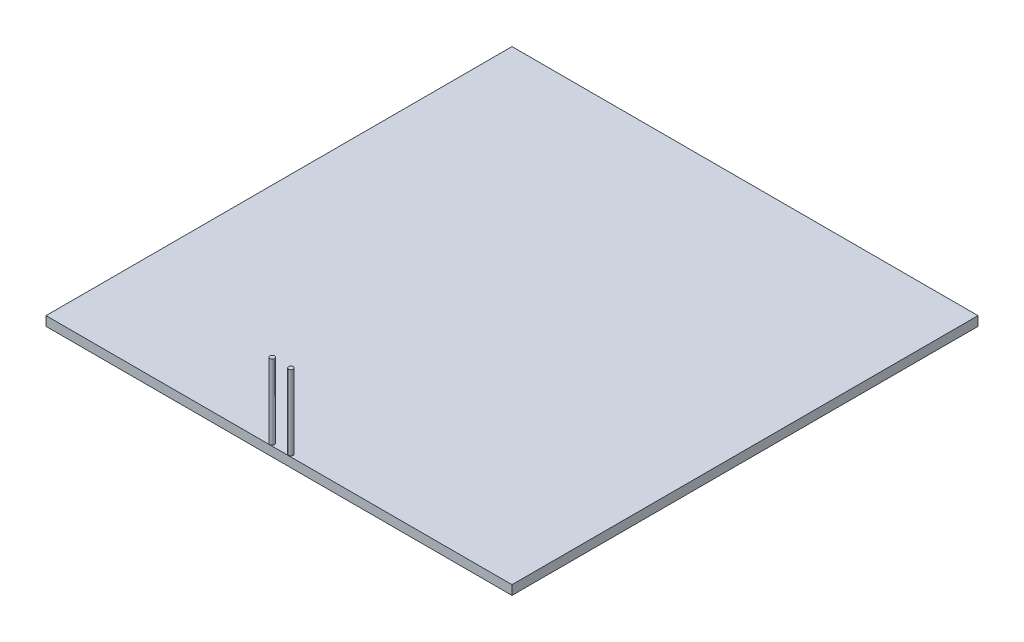
from build123d import *

# Parameters (mm, degrees)
SKETCH2_W           = 500
SKETCH2_H           = 500
BOSS_EXTRUDE1_DEPTH = 10
SKETCH5_R           = 2.475
BOSS_EXTRUDE2_DEPTH = 80


with BuildPart() as part:
    # Sketch2 → Boss-Extrude1 (new body)
    with BuildSketch(Plane(origin=(0, 0, 0), x_dir=(1, 0, 0), z_dir=(0, 1, 0))):
        Rectangle(SKETCH2_W, SKETCH2_H)
    extrude(amount=BOSS_EXTRUDE1_DEPTH)

    # Sketch5 → Boss-Extrude2 (add)
    with BuildSketch(Plane(origin=(0, 10, 0), x_dir=(1, 0, 0), z_dir=(0, 1, 0))):
        with Locations(Location((-9.999775225, -247.263176953, 0), (0, 0, 270))):
            Circle(SKETCH5_R)
        with Locations(Location((10, -247.168356243, 0), (0, 0, 270))):
            Circle(SKETCH5_R)
    extrude(amount=BOSS_EXTRUDE2_DEPTH)


solid = part.part
